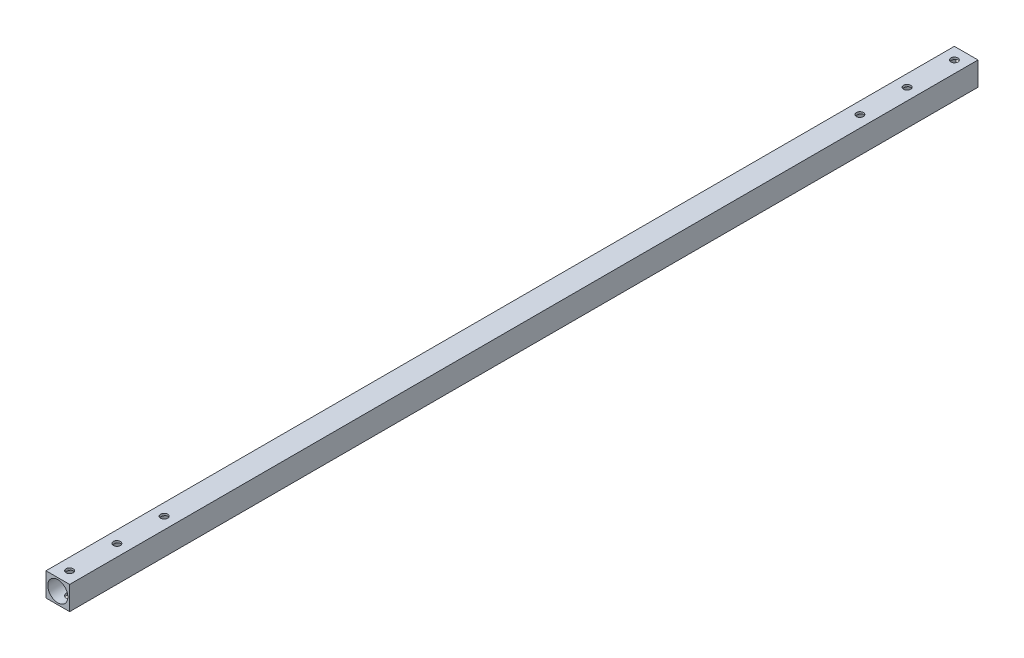
from build123d import *

# Parameters (mm, degrees)
SKETCH1_W           = 10
SKETCH1_H           = 10
SKETCH1_R           = 4.25
BOSS_EXTRUDE1_DEPTH = 384.4
SKETCH2_R           = 1.5
CUT_EXTRUDE1_DEPTH  = 385.56255668


with BuildPart() as part:
    # Sketch1 → Boss-Extrude1 (new body)
    with BuildSketch(Plane.XY):
        Rectangle(SKETCH1_W, SKETCH1_H)
        Circle(SKETCH1_R, mode=Mode.SUBTRACT)
    extrude(amount=BOSS_EXTRUDE1_DEPTH)

    # Sketch2 → Cut-Extrude1 (cut, through all)
    with BuildSketch(Plane(origin=(0, 5, 0), x_dir=(1, 0, 0), z_dir=(0, 1, 0))):
        with Locations(Location((0, -5, 0), (0, 0, 270))):
            Circle(SKETCH2_R)
        with Locations(Location((0, -25, 0), (0, 0, 270))):
            Circle(SKETCH2_R)
        with Locations(Location((0, -45, 0), (0, 0, 270))):
            Circle(SKETCH2_R)
        with Locations(Location((0, -379.4, 0), (0, 0, 270))):
            Circle(SKETCH2_R)
        with Locations(Location((0, -359.4, 0), (0, 0, 270))):
            Circle(SKETCH2_R)
        with Locations(Location((0, -339.4, 0), (0, 0, 270))):
            Circle(SKETCH2_R)
    extrude(amount=-CUT_EXTRUDE1_DEPTH, mode=Mode.SUBTRACT)


solid = part.part
